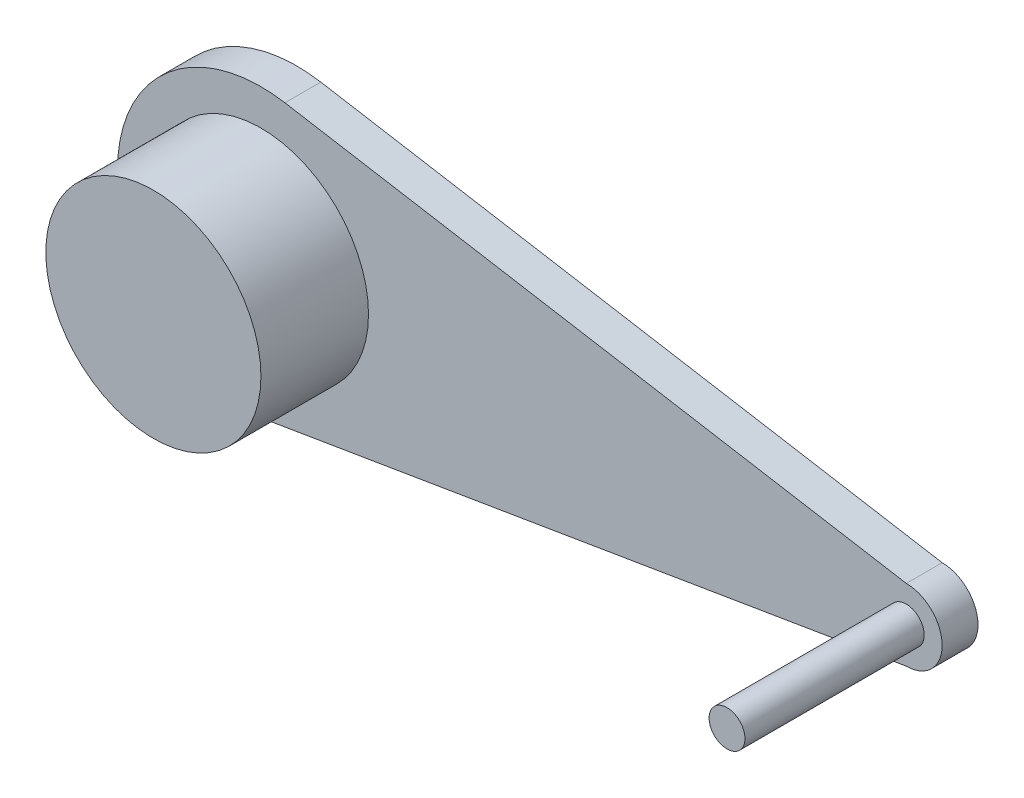
from build123d import *

# Parameters (mm, degrees)
BOSS_EXTRUDE1_DEPTH = 1
SKETCH2_R           = 0.5
SKETCH2_R_2         = 3
BOSS_EXTRUDE2_DEPTH = 3
SKETCH3_R           = 0.5
BOSS_EXTRUDE3_DEPTH = 2


with BuildPart() as part:
    # Sketch1 → Boss-Extrude1 (new body)
    with BuildSketch(Plane.XY):
        with BuildLine():
            Line((18, 1), (0.669804359, 3.943521538))
            ThreePointArc((0.669804359, 3.943521538), (-3.985855376, 0.336090648), (0, -4))
            Line((0, -4), (18, -1))
            ThreePointArc((18, -1), (19, 0), (18, 1))
        make_face()
    extrude(amount=BOSS_EXTRUDE1_DEPTH)

    # Sketch2 → Boss-Extrude2 (add)
    with BuildSketch(Plane.XY.offset(1)):
        with Locations((18, 0)):
            Circle(SKETCH2_R)
        Circle(SKETCH2_R_2)
    extrude(amount=BOSS_EXTRUDE2_DEPTH)

    # Sketch3 → Boss-Extrude3 (add)
    with BuildSketch(Plane.XY.offset(4)):
        with Locations((18, 0)):
            Circle(SKETCH3_R)
    extrude(amount=BOSS_EXTRUDE3_DEPTH)


solid = part.part
